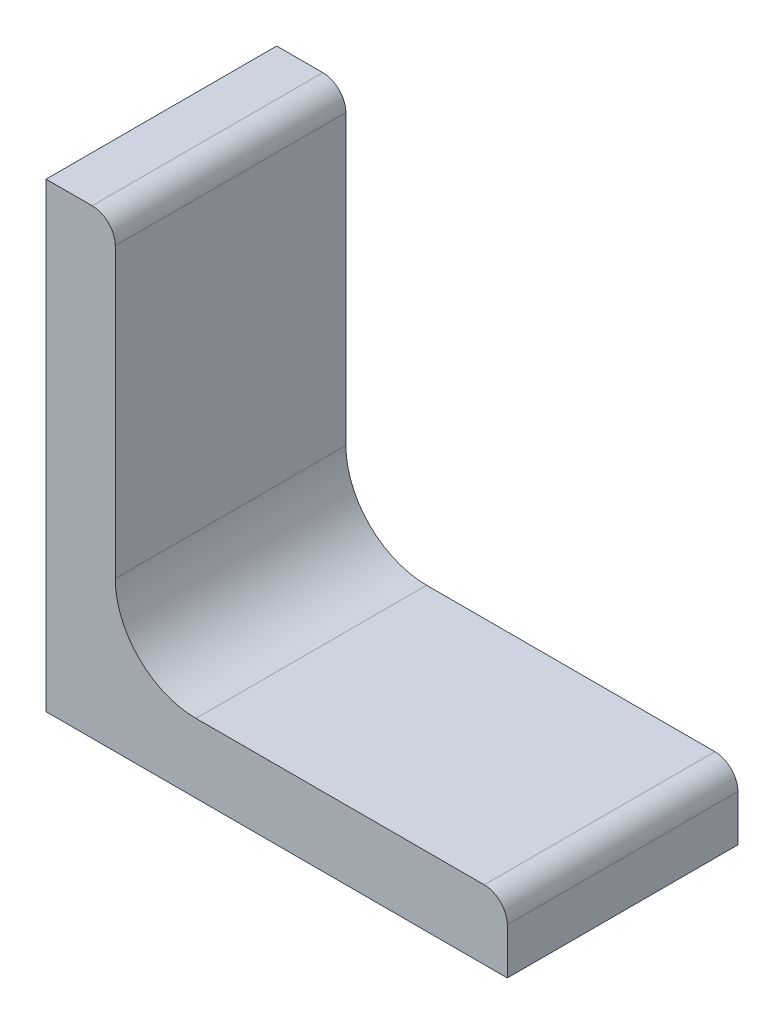
from build123d import *

# Parameters (mm, degrees)
EXTRUDE_1_DEPTH = 10
FILLET_1_R      = 1
FILLET_2_R      = 3.5


with BuildPart() as part:
    # 草图1 → 凸台-拉伸1 (new body)
    with BuildSketch(Plane(origin=(0, 0, 0), x_dir=(-1, 0, 0), z_dir=(0, 0, -1))):
        Polygon((0, 20), (0, 0), (-20, 0), (-20, 3), (-3, 3), (-3, 20), align=None)
    extrude(amount=-EXTRUDE_1_DEPTH)

    # 圆角1
    fillet_1_edges = [part.edges().sort_by_distance(p)[0] for p in [
        (20, 3, 5),
        (3, 20, 5),
    ]]
    fillet(fillet_1_edges, radius=FILLET_1_R)

    # 圆角2
    fillet_2_edges = [part.edges().sort_by_distance(p)[0] for p in [
        (3, 3, 5),
    ]]
    fillet(fillet_2_edges, radius=FILLET_2_R)


solid = part.part
